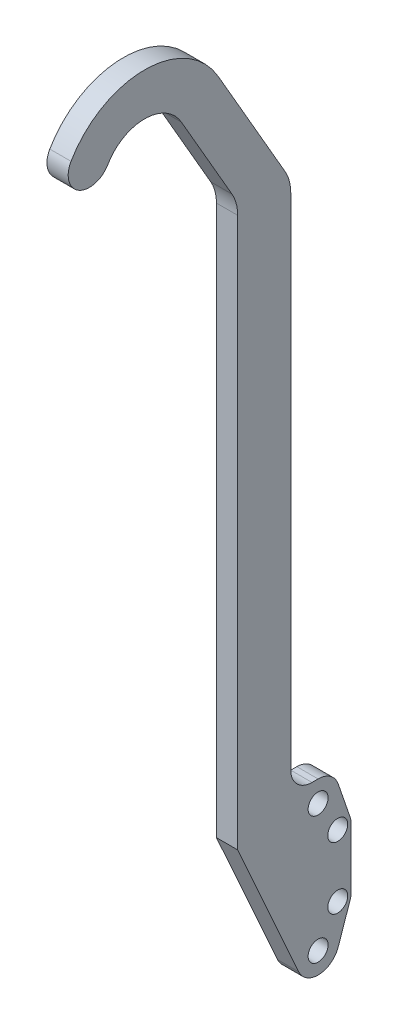
from build123d import *

# Parameters (mm, degrees)
BOSS_EXTRUDE1_DEPTH = 3.175
FILLET1_R           = 12.7
SKETCH2_R           = 2.9845
CUT_EXTRUDE1_DEPTH  = 248.533087061
FILLET2_R           = 6.35


with BuildPart() as part:
    # Sketch1 → Boss-Extrude1 (new, symmetric)
    with BuildSketch(Plane(origin=(0, 0, 0), x_dir=(0, 0, -1), z_dir=(1, 0, 0))):
        with BuildLine():
            Line((-8.731303996, -21.648910397), (-26.9875, 19.05))
            Line((-26.9875, 19.05), (-26.9875, 186.759204744))
            Line((-26.9875, 186.759204744), (-43.811945986, 215.9))
            ThreePointArc((-43.811945986, 215.9), (-54.810468614, 222.25), (-65.808991242, 215.9))
            ThreePointArc((-65.808991242, 215.9), (-74.483252556, 213.575738686), (-76.80751387, 222.25))
            ThreePointArc((-76.80751387, 222.25), (-54.810468614, 234.95), (-32.813423357, 222.25))
            Line((-32.813423357, 222.25), (-11.1125, 184.662898174))
            Line((-11.1125, 184.662898174), (-11.1125, 25.4))
            Line((-11.1125, 25.4), (-2.9375, 25.4))
            ThreePointArc((-2.9375, 25.4), (0.751942089, 24.218221848), (3.068123689, 21.112761283))
            Line((3.068123689, 21.112761283), (6.691014805, 10.56489959))
            ThreePointArc((6.691014805, 10.56489959), (6.852071397, 9.929208286), (6.90625, 9.275673789))
            Line((6.90625, 9.275673789), (6.90625, -9.275673789))
            ThreePointArc((6.90625, -9.275673789), (6.852071397, -9.929208286), (6.691014805, -10.56489959))
            Line((6.691014805, -10.56489959), (3.068123689, -21.112761283))
            ThreePointArc((3.068123689, -21.112761283), (-2.649262487, -25.393454827), (-8.731303996, -21.648910397))
        make_face()
    extrude(amount=BOSS_EXTRUDE1_DEPTH, both=True)

    # Fillet1
    fillet1_edges = [part.edges().sort_by_distance(p)[0] for p in [
        (0, 186.759204744, 26.9875),
        (0, 184.662898174, 11.1125),
    ]]
    fillet(fillet1_edges, radius=FILLET1_R)

    # Sketch2 → Cut-Extrude1 (cut, through all)
    with BuildSketch(Plane(origin=(3.175, 0, 0), x_dir=(0, 0, -1), z_dir=(1, 0, 0))):
        with Locations((-2.9375, 19.05)):
            Circle(SKETCH2_R)
        with Locations((2.9375, -9.275673789)):
            Circle(SKETCH2_R)
        with Locations((-2.9375, -19.05)):
            Circle(SKETCH2_R)
        with Locations((2.9375, 9.275673789)):
            Circle(SKETCH2_R)
    extrude(amount=-CUT_EXTRUDE1_DEPTH, mode=Mode.SUBTRACT)

    # Fillet2
    fillet2_edges = [part.edges().sort_by_distance(p)[0] for p in [
        (0, 25.4, 11.1125),
    ]]
    fillet(fillet2_edges, radius=FILLET2_R)


solid = part.part
